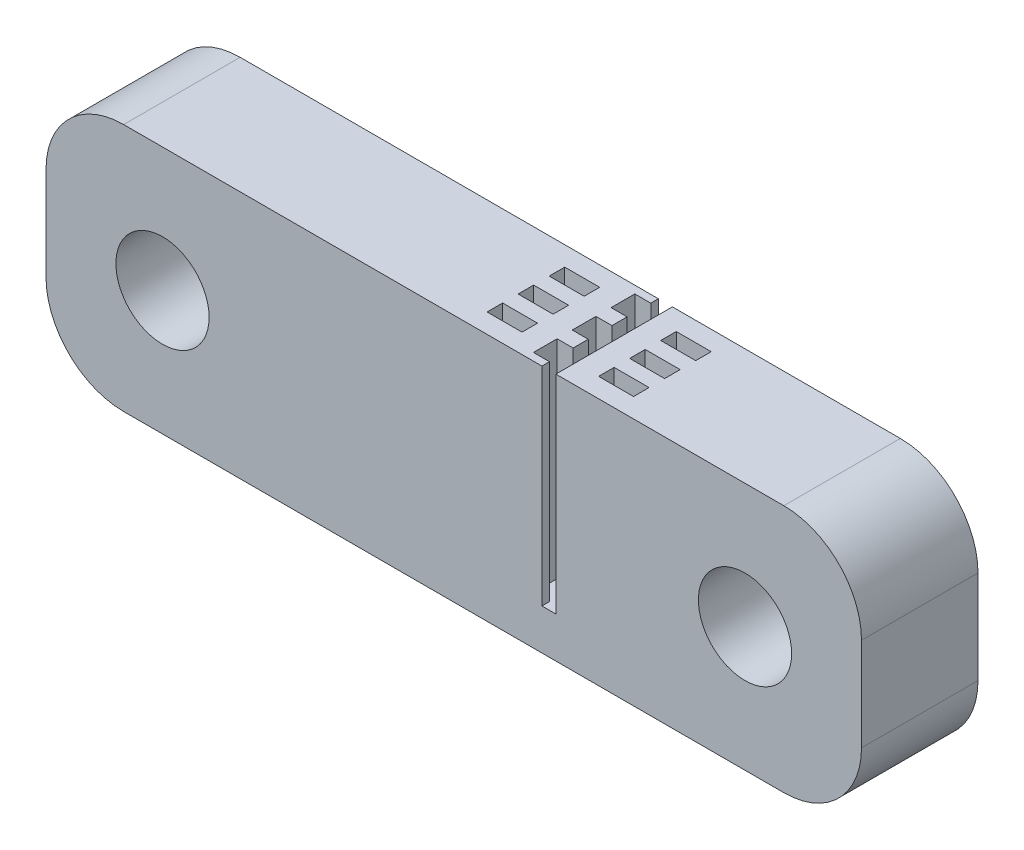
from build123d import *

# Parameters (mm, degrees)
SKETCH_1_R          = 6
EXTRUDE_1_DEPTH     = 7.5
CUT_EXTRUDE_1_DEPTH = 26.75
SKETCH_4_W          = 4.5
SKETCH_4_H          = 2
CUT_EXTRUDE_2_DEPTH = 7


with BuildPart() as part:
    # 草图1 → 凸台-拉伸1 (new, symmetric)
    with BuildSketch(Plane.XY):
        with BuildLine():
            Line((-42.5, 16), (42.5, 16))
            ThreePointArc((42.5, 16), (49.571067812, 13.071067812), (52.5, 6))
            Line((52.5, 6), (52.5, -6))
            ThreePointArc((52.5, -6), (49.571067812, -13.071067812), (42.5, -16))
            Line((42.5, -16), (-42.5, -16))
            ThreePointArc((-42.5, -16), (-49.571067812, -13.071067812), (-52.5, -6))
            Line((-52.5, -6), (-52.5, 6))
            ThreePointArc((-52.5, 6), (-49.571067812, 13.071067812), (-42.5, 16))
        make_face()
        with Locations((-37.5, 0)):
            Circle(SKETCH_1_R, mode=Mode.SUBTRACT)
        with Locations((37.5, 0)):
            Circle(SKETCH_1_R, mode=Mode.SUBTRACT)
    extrude(amount=EXTRUDE_1_DEPTH, both=True)

    # 草图2 → 切除-拉伸1 (cut)
    with BuildSketch(Plane(origin=(0, 16, 0), x_dir=(1, 0, 0), z_dir=(0, 1, 0))):
        Polygon((13.15, 7.5), (11.35, 7.5), (11.35, 6.52), (9.29, 6.52), (9.29, 3.47), (11.35, 3.47), (11.35, 1.52), (9.29, 1.52), (9.29, -1.53), (11.35, -1.53), (11.35, -3.48), (9.29, -3.48), (9.29, -6.53), (11.35, -6.53), (11.35, -7.5), (13.15, -7.5), align=None)
    extrude(amount=-CUT_EXTRUDE_1_DEPTH, mode=Mode.SUBTRACT)

    # 草图4 → 切除-拉伸2 (cut)
    with BuildSketch(Plane(origin=(0, 16, 0), x_dir=(1, 0, 0), z_dir=(0, 1, 0))):
        with Locations((4.04, 4)):
            Rectangle(SKETCH_4_W, SKETCH_4_H)
        with Locations((4.04, 0)):
            Rectangle(SKETCH_4_W, SKETCH_4_H)
        with Locations((4.04, -4)):
            Rectangle(SKETCH_4_W, SKETCH_4_H)
        with Locations((18.4, 4)):
            Rectangle(SKETCH_4_W, SKETCH_4_H)
        with Locations((18.4, 0)):
            Rectangle(SKETCH_4_W, SKETCH_4_H)
        with Locations((18.4, -4)):
            Rectangle(SKETCH_4_W, SKETCH_4_H)
    extrude(amount=-CUT_EXTRUDE_2_DEPTH, mode=Mode.SUBTRACT)


solid = part.part
